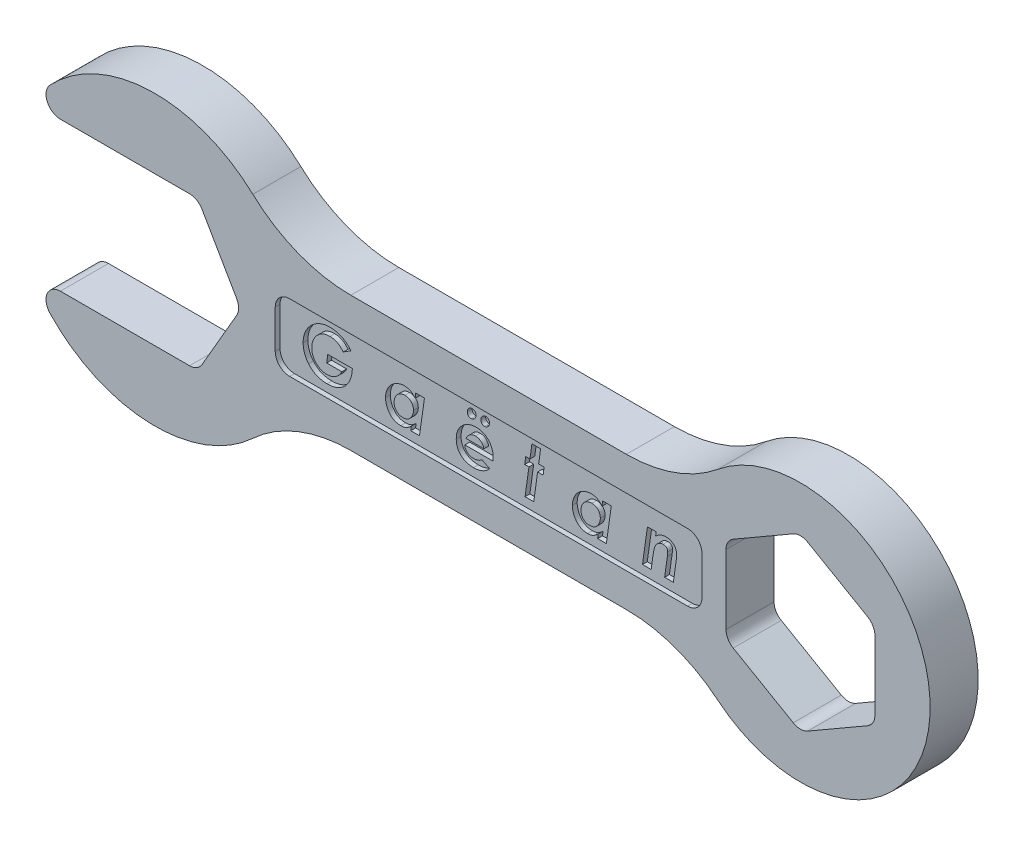
from build123d import *

# Parameters (mm, degrees)
ESQUISSE1_R                  = 27
BOSS_EXTRU_1_DEPTH           = 10
BOSS_EXTRU_2_DEPTH           = 10
ESQUISSE3_R                  = 30
BOSS_EXTRU_3_DEPTH           = 10
ENL_V_MAT_EXTRU_1_DEPTH      = 168.411635881
ENL_V_MAT_EXTRU_1_DEPTH_BACK = 168.411635881
CONG_1_R                     = 3
CONG_2_R                     = 30
CONG_3_R                     = 3
ESQUISSE5_W                  = 88.8410441
ESQUISSE5_H                  = 14
ENL_V_MAT_EXTRU_2_DEPTH      = 1
CONG_4_R                     = 3
ENL_V_MAT_EXTRU_3_DEPTH      = 1


with BuildPart() as part:
    # Esquisse1 → Boss.-Extru.1 (new body)
    with BuildSketch(Plane.XY):
        Circle(ESQUISSE1_R)
        Polygon((15.5, 8.948929172), (0, 17.897858345), (-15.5, 8.948929172), (-15.5, -8.948929172), (0, -17.897858345), (15.5, -8.948929172), align=None, mode=Mode.SUBTRACT)
    extrude(amount=BOSS_EXTRU_1_DEPTH)

    # Esquisse2 → Boss.-Extru.2 (add)
    with BuildSketch(Plane.XY.offset(10)):
        Polygon((-15.5, -8.948929172), (-15.5, -14), (-115.5, -14), (-115.5, 14), (-15.5, 14), (-15.5, 8.948929172), align=None)
    extrude(amount=-BOSS_EXTRU_2_DEPTH)

    # Esquisse3 → Boss.-Extru.3 (add)
    with BuildSketch(Plane.XY.offset(10)):
        with Locations((-134.397858345, 0)):
            Circle(ESQUISSE3_R)
        Polygon((-125.448929172, -15.5), (-116.5, 0), (-125.448929172, 15.5), (-143.346787517, 15.5), (-152.29571669, 0), (-143.346787517, -15.5), align=None, mode=Mode.SUBTRACT)
    extrude(amount=-BOSS_EXTRU_3_DEPTH)

    # Esquisse4 → Enlèv. mat.-Extru.1 (cut, two sides: drawn at the far end of the back side and taken through both)
    with BuildSketch(Plane.XY.offset(10).offset(-ENL_V_MAT_EXTRU_1_DEPTH_BACK)):
        with BuildLine():
            Line((-143.346787517, -15.5), (-160.083457423, -15.5))
            ThreePointArc((-160.083457423, -15.5), (-164.397858345, 0), (-160.083457423, 15.5))
            Line((-160.083457423, 15.5), (-143.346787517, 15.5))
            Line((-143.346787517, 15.5), (-143.346787517, -15.5))
        make_face()
    extrude(amount=ENL_V_MAT_EXTRU_1_DEPTH + ENL_V_MAT_EXTRU_1_DEPTH_BACK, mode=Mode.SUBTRACT)

    # Congé1
    cong_1_edges = [part.edges().sort_by_distance(p)[0] for p in [
        (-160.083457423, -15.5, 5),
        (-160.083457423, 15.5, 5),
    ]]
    fillet(cong_1_edges, radius=CONG_1_R)

    # Congé2
    cong_2_edges = [part.edges().sort_by_distance(p)[0] for p in [
        (-23.086792761, 14, 5),
        (-23.086792761, -14, 5),
        (-107.864860022, 14, 5),
        (-107.864860022, -14, 5),
    ]]
    fillet(cong_2_edges, radius=CONG_2_R)

    # Congé3
    cong_3_edges = [part.edges().sort_by_distance(p)[0] for p in [
        (0, -17.897858345, 5),
        (-15.5, -8.948929172, 5),
        (-15.5, 8.948929172, 5),
        (0, 17.897858345, 5),
        (15.5, 8.948929172, 5),
        (15.5, -8.948929172, 5),
        (-125.448929172, -15.5, 5),
        (-116.5, 0, 5),
        (-125.448929172, 15.5, 5),
    ]]
    fillet(cong_3_edges, radius=CONG_3_R)

    # Esquisse5 → Enlèv. mat.-Extru.2 (cut)
    with BuildSketch(Plane.XY.offset(10)):
        with Locations((-64.92052205, 0)):
            Rectangle(ESQUISSE5_W, ESQUISSE5_H)
    extrude(amount=-ENL_V_MAT_EXTRU_2_DEPTH, mode=Mode.SUBTRACT)

    # Congé4
    cong_4_edges = [part.edges().sort_by_distance(p)[0] for p in [
        (-109.3410441, -7, 9.5),
        (-109.3410441, 7, 9.5),
        (-20.5, 7, 9.5),
        (-20.5, -7, 9.5),
    ]]
    fillet(cong_4_edges, radius=CONG_4_R)

    # Esquisse6 → Enlèv. mat.-Extru.3 (cut)
    # profile 1 of 8: a face of its own
    with BuildSketch(Plane.XY.offset(9)):
        with BuildLine():
            Line((-94.571919832, 2.989043012), (-96.164467908, 1.991446858))
            add(Edge.make_bspline(
                [(-96.164467908, 1.991446858), (-96.277419058, 2.114827834), (-96.493196821, 2.350530359), (-96.831645132, 2.658707701), (-97.165043986, 2.90689395), (-97.498557313, 3.095834839), (-97.839775163, 3.236146336), (-98.19822987, 3.330547414), (-98.577652701, 3.390579904), (-98.837846108, 3.397938625), (-98.970958293, 3.401703269)],
                knots=[0, 0, 0, 0, 1.232977487, 2.355435308, 3.369770187, 4.291348691, 5.174604885, 6.082334442, 7.018942652, 8, 8, 8, 8], degree=3))
            add(Edge.make_bspline(
                [(-98.970958293, 3.401703269), (-99.115490325, 3.397872295), (-99.399547131, 3.39034307), (-99.813844544, 3.319094313), (-100.208591632, 3.210124919), (-100.582099351, 3.052289515), (-100.9345934, 2.848057336), (-101.266496712, 2.599964661), (-101.578041363, 2.30777085), (-101.761788383, 2.085078149), (-101.855573678, 1.971414807)],
                knots=[0, 0, 0, 0, 1.037106879, 2.038283569, 3.009830787, 3.972569298, 4.94146214, 5.928319872, 6.942605276, 8, 8, 8, 8], degree=3))
            add(Edge.make_bspline(
                [(-101.855573678, 1.971414807), (-101.926026019, 1.876399767), (-102.065201268, 1.688702076), (-102.242852967, 1.389991436), (-102.395935738, 1.085806484), (-102.521428475, 0.773103162), (-102.617449981, 0.45249395), (-102.685266921, 0.123347031), (-102.729103951, -0.212900732), (-102.734347847, -0.440309401), (-102.736983934, -0.55462686)],
                knots=[0, 0, 0, 0, 1.040960542, 2.056368018, 3.055559505, 4.03710588, 5.019268411, 5.998275661, 6.99374091, 8, 8, 8, 8], degree=3))
            add(Edge.make_bspline(
                [(-102.736983934, -0.55462686), (-102.734286479, -0.666254047), (-102.728968754, -0.886314242), (-102.687074815, -1.209356475), (-102.613250134, -1.517860985), (-102.51644785, -1.814171587), (-102.386816862, -2.095602765), (-102.229910574, -2.363420949), (-102.04444359, -2.616900645), (-101.832726331, -2.853929165), (-101.601070758, -3.07033734), (-101.353747156, -3.260016609), (-101.093168094, -3.419671609), (-100.819229088, -3.550406698), (-100.532100636, -3.653307307), (-100.231078726, -3.724668684), (-99.917889461, -3.770586023), (-99.704294808, -3.775361672), (-99.595958293, -3.777783911)],
                knots=[0, 0, 0, 0, 1.066897471, 2.103265977, 3.106535126, 4.095591644, 5.078159493, 6.062322472, 7.058152725, 8.075375883, 9.096057735, 10.084186963, 11.049730852, 12.011871914, 12.980953841, 13.959387168, 14.96498868, 16, 16, 16, 16], degree=3))
            add(Edge.make_bspline(
                [(-99.595958293, -3.777783911), (-99.514435579, -3.776273504), (-99.353034451, -3.773283154), (-99.11405091, -3.74854225), (-98.8804909, -3.708356851), (-98.652665022, -3.652823879), (-98.430597384, -3.579805203), (-98.213819767, -3.491296245), (-98.001734383, -3.387877411), (-97.796704058, -3.266502687), (-97.598400333, -3.131075327), (-97.409626621, -2.97820592), (-97.230806058, -2.808841949), (-97.060505165, -2.623875383), (-96.897611621, -2.424292465), (-96.747934509, -2.205923412), (-96.604789837, -1.973586972), (-96.518751271, -1.809837101), (-96.474964703, -1.72650186)],
                knots=[0, 0, 0, 0, 0.990751711, 1.961520103, 2.916931976, 3.869720035, 4.809138875, 5.755683625, 6.713987145, 7.674487982, 8.649319602, 9.630449541, 10.623757948, 11.640402946, 12.684918653, 13.752145235, 14.856026455, 16, 16, 16, 16], degree=3))
            Line((-96.474964703, -1.72650186), (-99.632015985, -1.72650186))
            Line((-99.632015985, -1.72650186), (-99.403650601, -0.059835193))
            Line((-99.403650601, -0.059835193), (-94.275445473, -0.059835193))
            add(Edge.make_bspline(
                [(-94.275445473, -0.059835193), (-94.288272854, -0.261135302), (-94.313357329, -0.654785982), (-94.404135998, -1.227988249), (-94.53858283, -1.768558767), (-94.712857132, -2.278580324), (-94.928718388, -2.757101648), (-95.189521398, -3.202825727), (-95.490156054, -3.617428393), (-95.833353404, -3.995474513), (-96.20915588, -4.334690114), (-96.610537731, -4.6343778), (-97.040546552, -4.882963894), (-97.493450118, -5.088310958), (-97.971030947, -5.249818953), (-98.474503274, -5.363046668), (-99.003043631, -5.432839648), (-99.364035163, -5.440532667), (-99.54788137, -5.444450578)],
                knots=[0, 0, 0, 0, 1.148955532, 2.246830018, 3.301660101, 4.319666133, 5.314146826, 6.287838685, 7.257462643, 8.227280698, 9.191724348, 10.138440807, 11.076252923, 12.016254752, 12.968042649, 13.943717582, 14.952773983, 16, 16, 16, 16], degree=3))
            add(Edge.make_bspline(
                [(-99.54788137, -5.444450578), (-99.648740567, -5.44345046), (-99.847994705, -5.441474661), (-100.1422145, -5.421177596), (-100.428167057, -5.386524913), (-100.705672683, -5.341008129), (-100.975954864, -5.282831074), (-101.237623978, -5.21118896), (-101.491287214, -5.125071663), (-101.735357506, -5.023038662), (-101.975031971, -4.915383095), (-102.202871638, -4.787135166), (-102.424477974, -4.649477628), (-102.636366611, -4.496461247), (-102.841731538, -4.33215287), (-103.037461789, -4.153923727), (-103.225270035, -3.962479877), (-103.342673065, -3.826514489), (-103.402048037, -3.75775186)],
                knots=[0, 0, 0, 0, 1.111499042, 2.195841241, 3.24834816, 4.285223882, 5.294222847, 6.294054786, 7.273859608, 8.244193736, 9.208986092, 10.167555097, 11.123181443, 12.083077344, 13.046240314, 14.020501641, 14.998895854, 16, 16, 16, 16], degree=3))
            add(Edge.make_bspline(
                [(-103.402048037, -3.75775186), (-103.492301507, -3.64376783), (-103.671496177, -3.417457082), (-103.90153463, -3.05280626), (-104.097844279, -2.672513108), (-104.25505173, -2.274634618), (-104.380732109, -1.862241568), (-104.468465193, -1.43306766), (-104.521247352, -0.987978159), (-104.528290254, -0.685647007), (-104.531855729, -0.532591603)],
                knots=[0, 0, 0, 0, 0.999328569, 1.984127054, 2.959716786, 3.938705326, 4.922250225, 5.921072174, 6.947541011, 8, 8, 8, 8], degree=3))
            add(Edge.make_bspline(
                [(-104.531855729, -0.532591603), (-104.527066492, -0.345330112), (-104.517616154, 0.024182671), (-104.436131046, 0.567453084), (-104.309384706, 1.092419785), (-104.124963592, 1.596453848), (-103.892159463, 2.082415673), (-103.604561183, 2.546576558), (-103.269134721, 2.994100413), (-102.88295103, 3.412804014), (-102.464152011, 3.799767406), (-102.019453081, 4.139675802), (-101.553143019, 4.425786183), (-101.069026342, 4.662719438), (-100.562481952, 4.842868733), (-100.037962039, 4.973249329), (-99.492961203, 5.054042999), (-99.122813155, 5.063545708), (-98.934900601, 5.068369935)],
                knots=[0, 0, 0, 0, 1.022519879, 2.01768214, 2.99445506, 3.968403767, 4.944092992, 5.933246428, 6.946641619, 7.994936793, 9.040543676, 10.058341478, 11.047494914, 12.024771785, 12.997483176, 13.978673844, 14.973836105, 16, 16, 16, 16], degree=3))
            add(Edge.make_bspline(
                [(-98.934900601, 5.068369935), (-98.793865295, 5.066084321), (-98.513029442, 5.061533103), (-98.09557903, 5.012235686), (-97.682666972, 4.939787971), (-97.278292694, 4.832505996), (-96.885112506, 4.701664459), (-96.50846647, 4.545031186), (-96.151988233, 4.363103439), (-95.813036558, 4.154064145), (-95.488245835, 3.915513975), (-95.171476627, 3.643021751), (-94.863720546, 3.332651357), (-94.67058781, 3.105228953), (-94.571919832, 2.989043012)],
                knots=[0, 0, 0, 0, 1.014010841, 2.019144067, 3.019687909, 4.027399918, 5.025300219, 5.998481464, 6.958680332, 7.901091373, 8.859847597, 9.854378501, 10.903841272, 12, 12, 12, 12], degree=3))
        make_face()
    # profile 2 of 8: a face of its own
    with BuildSketch(Plane.XY.offset(9)):
        with BuildLine():
            Line((-81.083939062, 2.119651987), (-79.273041626, 2.119651987))
            Line((-79.273041626, 2.119651987), (-80.310701883, -5.188040321))
            Line((-80.310701883, -5.188040321), (-82.121599319, -5.188040321))
            Line((-82.121599319, -5.188040321), (-81.995397396, -4.294610834))
            add(Edge.make_bspline(
                [(-81.995397396, -4.294610834), (-82.0895592, -4.384240072), (-82.269109058, -4.555147129), (-82.547199891, -4.776870844), (-82.814894883, -4.9571942), (-83.078811967, -5.095499884), (-83.346200206, -5.195842891), (-83.623750028, -5.265343641), (-83.917105045, -5.308810608), (-84.117971174, -5.313725506), (-84.220958293, -5.316245449)],
                knots=[0, 0, 0, 0, 1.236324186, 2.357450916, 3.379388742, 4.30284698, 5.185433758, 6.089881904, 7.020653398, 8, 8, 8, 8], degree=3))
            add(Edge.make_bspline(
                [(-84.220958293, -5.316245449), (-84.338674928, -5.313503079), (-84.569216749, -5.308132291), (-84.90551363, -5.25615881), (-85.223434043, -5.174873397), (-85.5231277, -5.060177194), (-85.802975255, -4.910466063), (-86.065655958, -4.728980314), (-86.308794413, -4.513485833), (-86.529056074, -4.266833062), (-86.727698416, -4.000988481), (-86.900477198, -3.720068469), (-87.050504246, -3.430645687), (-87.167277116, -3.127432687), (-87.263671976, -2.816100159), (-87.328202292, -2.492495849), (-87.369829032, -2.158943176), (-87.375261625, -1.932958393), (-87.378009575, -1.818649296)],
                knots=[0, 0, 0, 0, 1.072254913, 2.099954687, 3.093402483, 4.05863531, 5.017013142, 5.979305845, 6.962352722, 7.970695896, 8.988290287, 9.983079422, 10.973839091, 11.95483031, 12.940586347, 13.940815436, 14.958409826, 16, 16, 16, 16], degree=3))
            add(Edge.make_bspline(
                [(-87.378009575, -1.818649296), (-87.376630759, -1.730444021), (-87.373887871, -1.554976709), (-87.346797222, -1.293247041), (-87.302656363, -1.035081459), (-87.242032506, -0.779623273), (-87.1664656, -0.526942523), (-87.07200178, -0.277947328), (-86.958689862, -0.03313905), (-86.831321988, 0.207775355), (-86.690734969, 0.441890237), (-86.533027812, 0.661627407), (-86.367478012, 0.871002708), (-86.18877532, 1.065910859), (-85.997370115, 1.245715574), (-85.797208027, 1.416086673), (-85.581843746, 1.568770121), (-85.358860906, 1.711740389), (-85.126964278, 1.836228271), (-84.892438443, 1.948098457), (-84.653471864, 2.039295855), (-84.413078121, 2.116495021), (-84.169161709, 2.174467967), (-83.922913601, 2.21613913), (-83.674044356, 2.243794026), (-83.507222142, 2.246501363), (-83.423682652, 2.247857115)],
                knots=[0, 0, 0, 0, 1.010861959, 2.01091412, 3.012605424, 4.011485121, 5.018863341, 6.033918867, 7.061452407, 8.109228878, 9.15680961, 10.18900835, 11.207521355, 12.215190347, 13.216881651, 14.216552911, 15.225616441, 16.240671966, 17.251099115, 18.240697123, 19.217272556, 20.180771028, 21.133199006, 22.08832996, 23.042693801, 24, 24, 24, 24], degree=3))
            add(Edge.make_bspline(
                [(-83.423682652, 2.247857115), (-83.312585771, 2.244691937), (-83.093597875, 2.238452917), (-82.772858072, 2.179966858), (-82.465595343, 2.087464635), (-82.172570263, 1.959187864), (-81.897383967, 1.795734879), (-81.648072372, 1.594394628), (-81.419002212, 1.363612336), (-81.293790615, 1.184841133), (-81.230173037, 1.094010961)],
                knots=[0, 0, 0, 0, 1.030509072, 2.031281277, 3.015697838, 4.003854478, 4.993584726, 5.977161716, 6.972235198, 8, 8, 8, 8], degree=3))
            Line((-81.230173037, 1.094010961), (-81.083939062, 2.119651987))
        make_face()
        with BuildLine():
            add(Edge.make_bspline(
                [(-83.818314062, -3.649578783), (-83.71388913, -3.646351159), (-83.510241026, -3.64005669), (-83.216024056, -3.584297883), (-82.941854782, -3.496492122), (-82.688147484, -3.370973597), (-82.454029672, -3.205890685), (-82.241518864, -2.999854791), (-82.049576722, -2.753038153), (-81.881246726, -2.472876878), (-81.740568327, -2.171565884), (-81.637495536, -1.8604959), (-81.571763243, -1.545637561), (-81.564383312, -1.333518143), (-81.560701883, -1.227703783)],
                knots=[0, 0, 0, 0, 1.017901168, 1.985097214, 2.910041334, 3.818973104, 4.735274743, 5.693545178, 6.695670165, 7.777101795, 8.875856117, 9.932619244, 10.968700869, 12, 12, 12, 12], degree=3))
            add(Edge.make_bspline(
                [(-81.560701883, -1.227703783), (-81.562385983, -1.161543843), (-81.56569561, -1.031525021), (-81.587329759, -0.841659408), (-81.625361193, -0.661800241), (-81.67992974, -0.492058632), (-81.749632862, -0.332252034), (-81.834987147, -0.181911956), (-81.934773811, -0.042091072), (-82.04947085, 0.087091193), (-82.177645113, 0.201541305), (-82.313545439, 0.306466258), (-82.463489727, 0.388858433), (-82.620209744, 0.460755607), (-82.787988133, 0.513789359), (-82.964541549, 0.555110838), (-83.152076144, 0.576113591), (-83.280077237, 0.579472275), (-83.345557652, 0.581190448)],
                knots=[0, 0, 0, 0, 1.109141645, 2.179707075, 3.198451464, 4.18615572, 5.163657463, 6.116161664, 7.079133258, 8.038519567, 9.005387219, 9.956904198, 10.909408399, 11.866440704, 12.843493655, 13.853714903, 14.902043453, 16, 16, 16, 16], degree=3))
            add(Edge.make_bspline(
                [(-83.345557652, 0.581190448), (-83.421809654, 0.579526012), (-83.572340996, 0.5762402), (-83.793544996, 0.542304083), (-84.006896867, 0.491633295), (-84.210330926, 0.415806748), (-84.405969774, 0.322348928), (-84.590771363, 0.204271225), (-84.768328652, 0.067451605), (-84.934871859, -0.089408877), (-85.086780017, -0.262970349), (-85.219732112, -0.45020679), (-85.332872893, -0.650050517), (-85.425063703, -0.862189038), (-85.494863426, -1.087531469), (-85.547383376, -1.323165973), (-85.577632535, -1.572135368), (-85.58127315, -1.741778449), (-85.58313778, -1.828665321)],
                knots=[0, 0, 0, 0, 0.994897251, 1.964056203, 2.915642991, 3.853470011, 4.79324038, 5.741466074, 6.711095529, 7.716481674, 8.723680824, 9.71796663, 10.70964959, 11.717112863, 12.731868792, 13.785363818, 14.865719672, 16, 16, 16, 16], degree=3))
            add(Edge.make_bspline(
                [(-85.58313778, -1.828665321), (-85.581423622, -1.895482824), (-85.578071444, -2.026150001), (-85.55699209, -2.217628059), (-85.51594215, -2.398304381), (-85.462038516, -2.569355665), (-85.39403764, -2.730946632), (-85.309340722, -2.88208943), (-85.208503109, -3.023066272), (-85.09297705, -3.152731296), (-84.964335125, -3.268163523), (-84.828009149, -3.37188354), (-84.681073602, -3.457759659), (-84.525534171, -3.528772238), (-84.360821245, -3.582734144), (-84.187518679, -3.619966994), (-84.006026897, -3.64543278), (-83.881839879, -3.648175692), (-83.818314062, -3.649578783)],
                knots=[0, 0, 0, 0, 1.124431694, 2.198919568, 3.234766021, 4.236791382, 5.213425507, 6.179206721, 7.145706547, 8.12447102, 9.094881178, 10.04988442, 11.001776355, 11.952075609, 12.922030374, 13.911569148, 14.931697721, 16, 16, 16, 16], degree=3))
        make_face(mode=Mode.SUBTRACT)
    # profile 3 of 8: a face of its own
    with BuildSketch(Plane.XY.offset(9)):
        with BuildLine():
            Line((-67.291471114, -3.026581988), (-65.722961498, -3.831870449))
            add(Edge.make_bspline(
                [(-65.722961498, -3.831870449), (-65.815622752, -3.942737196), (-66.001872333, -4.165579909), (-66.336693501, -4.454399124), (-66.711296099, -4.710417088), (-67.126989144, -4.926913661), (-67.575918538, -5.102272841), (-68.052936197, -5.224328429), (-68.55279933, -5.304324781), (-68.894385916, -5.312223567), (-69.068314062, -5.316245449)],
                knots=[0, 0, 0, 0, 0.914244933, 1.837636877, 2.790537697, 3.784087733, 4.800790172, 5.83726639, 6.89878507, 8, 8, 8, 8], degree=3))
            add(Edge.make_bspline(
                [(-69.068314062, -5.316245449), (-69.204005864, -5.313939148), (-69.468136064, -5.30944983), (-69.853188467, -5.263386723), (-70.217062917, -5.193248582), (-70.557910051, -5.090104092), (-70.878634156, -4.96234155), (-71.175278477, -4.801632307), (-71.449773576, -4.611216439), (-71.702144596, -4.396270052), (-71.926396591, -4.154521065), (-72.124112877, -3.894385573), (-72.288910616, -3.61255085), (-72.426416409, -3.313833293), (-72.529707118, -2.994018546), (-72.606581586, -2.657046016), (-72.6502843, -2.299892057), (-72.656750065, -2.055810597), (-72.660060857, -1.930828783)],
                knots=[0, 0, 0, 0, 1.167516698, 2.272623801, 3.333371772, 4.353538571, 5.333382306, 6.300396664, 7.250661637, 8.204535574, 9.148031545, 10.083792083, 11.011414416, 11.952824574, 12.908912643, 13.898953575, 14.92416002, 16, 16, 16, 16], degree=3))
            add(Edge.make_bspline(
                [(-72.660060857, -1.930828783), (-72.657098035, -1.787048272), (-72.651270931, -1.50426931), (-72.590380495, -1.089899593), (-72.496584471, -0.691934241), (-72.365119274, -0.310598078), (-72.191727367, 0.052404075), (-71.986144228, 0.401280557), (-71.737415772, 0.729777005), (-71.456336232, 1.038732446), (-71.149098483, 1.320183834), (-70.823333049, 1.568959295), (-70.480138442, 1.778690433), (-70.12205084, 1.95123103), (-69.747380593, 2.08522986), (-69.35699017, 2.177800367), (-68.951385098, 2.238952655), (-68.675243669, 2.244864535), (-68.535461498, 2.247857115)],
                knots=[0, 0, 0, 0, 1.05529311, 2.075487762, 3.068699193, 4.055083011, 5.031283693, 6.018666653, 7.023995929, 8.051577733, 9.082465902, 10.079966066, 11.057287041, 12.031169187, 12.994424047, 13.973330935, 14.974104677, 16, 16, 16, 16], degree=3))
            add(Edge.make_bspline(
                [(-68.535461498, 2.247857115), (-68.45063295, 2.245974391), (-68.283417398, 2.242263133), (-68.035645699, 2.223114205), (-67.795882746, 2.185754779), (-67.562418725, 2.139223604), (-67.337183875, 2.074113632), (-67.118944837, 1.995309451), (-66.905449005, 1.906597551), (-66.701981943, 1.798882032), (-66.504866956, 1.682426044), (-66.320448578, 1.548086939), (-66.143996923, 1.404962374), (-65.978589966, 1.248130586), (-65.826769316, 1.076730952), (-65.683428686, 0.893952875), (-65.551971554, 0.697184156), (-65.42974645, 0.490381975), (-65.322750079, 0.273311426), (-65.225405786, 0.053086923), (-65.148336006, -0.17420704), (-65.080357474, -0.404172511), (-65.032452358, -0.64110084), (-64.992009781, -0.881281671), (-64.973601342, -1.126590486), (-64.969711266, -1.291120332), (-64.967753165, -1.373937757)],
                knots=[0, 0, 0, 0, 1.072343926, 2.113823519, 3.137889586, 4.13760148, 5.120645553, 6.097657508, 7.069516392, 8.039614793, 9.005002879, 9.960565349, 10.920144366, 11.87525951, 12.837543921, 13.811635494, 14.808779264, 15.826321551, 16.845367656, 17.865985152, 18.866871901, 19.876579391, 20.894541571, 21.919893521, 22.952961626, 24, 24, 24, 24], degree=3))
            add(Edge.make_bspline(
                [(-64.967753165, -1.373937757), (-64.968609393, -1.428709101), (-64.970386358, -1.542378398), (-64.982879367, -1.720224856), (-65.005209109, -1.911238458), (-65.025426193, -2.043067712), (-65.035862139, -2.111117244)],
                knots=[0, 0, 0, 0, 0.886860648, 1.840539587, 2.885298471, 4, 4, 4, 4], degree=3))
            Line((-65.035862139, -2.111117244), (-70.865189062, -2.111117244))
            add(Edge.make_bspline(
                [(-70.865189062, -2.111117244), (-70.861363959, -2.16861727), (-70.853902064, -2.28078656), (-70.828711033, -2.444246023), (-70.785875689, -2.597734916), (-70.729369096, -2.742297044), (-70.661172165, -2.879589292), (-70.579259679, -3.008988803), (-70.480095572, -3.126533162), (-70.369339222, -3.235897301), (-70.245884586, -3.333586877), (-70.110270832, -3.417616048), (-69.964908345, -3.491563697), (-69.80620009, -3.547888216), (-69.637720384, -3.594925016), (-69.457829929, -3.625858987), (-69.267138436, -3.646989536), (-69.135818015, -3.648699693), (-69.068314062, -3.649578783)],
                knots=[0, 0, 0, 0, 1.040300458, 2.029386266, 2.980027991, 3.911437883, 4.828060054, 5.744444316, 6.66911896, 7.598419554, 8.551199615, 9.504589747, 10.47513087, 11.489753162, 12.539789264, 13.630032591, 14.781741895, 16, 16, 16, 16], degree=3))
            add(Edge.make_bspline(
                [(-69.068314062, -3.649578783), (-68.986121338, -3.647443441), (-68.823263331, -3.643212441), (-68.582249386, -3.615855151), (-68.348819292, -3.564395155), (-68.122371707, -3.496434921), (-67.902030993, -3.411006954), (-67.691842061, -3.30058416), (-67.485589402, -3.175220744), (-67.356728362, -3.076550264), (-67.291471114, -3.026581988)],
                knots=[0, 0, 0, 0, 1.027214308, 2.035339218, 3.025519259, 4.010199041, 4.987959988, 5.973205312, 6.973599434, 8, 8, 8, 8], degree=3))
        make_face()
        with BuildLine():
            add(Edge.make_bspline(
                [(-66.890830088, -0.829065962), (-66.926450284, -0.719006924), (-66.995037538, -0.507086495), (-67.144649688, -0.219396822), (-67.327280572, 0.026409765), (-67.543154803, 0.22856904), (-67.788138902, 0.386009981), (-68.057564398, 0.499880195), (-68.351619208, 0.570024521), (-68.556431603, 0.577400631), (-68.661663421, 0.581190448)],
                knots=[0, 0, 0, 0, 1.131480038, 2.178682812, 3.159669316, 4.117470342, 5.058967564, 5.99670948, 6.970717055, 8, 8, 8, 8], degree=3))
            add(Edge.make_bspline(
                [(-68.661663421, 0.581190448), (-68.766939726, 0.577493293), (-68.974596402, 0.570200684), (-69.276299704, 0.495896435), (-69.563715163, 0.381440698), (-69.830626267, 0.217708808), (-70.077674532, 0.015810532), (-70.289720046, -0.230828675), (-70.476594851, -0.511496766), (-70.567864201, -0.721233979), (-70.614788421, -0.829065962)],
                knots=[0, 0, 0, 0, 0.983432494, 1.939812791, 2.890131691, 3.868528921, 4.858194814, 5.863362488, 6.901492691, 8, 8, 8, 8], degree=3))
            Line((-70.614788421, -0.829065962), (-66.890830088, -0.829065962))
        make_face(mode=Mode.SUBTRACT)
    # profile 4 of 8: a face of its own
    with BuildSketch(Plane.XY.offset(9)):
        with BuildLine():
            add(Edge.make_bspline(
                [(-69.320717908, 5.196575063), (-69.268954684, 5.194192723), (-69.167428122, 5.189520083), (-69.021819024, 5.143048616), (-68.888870081, 5.067895335), (-68.775035887, 4.96298994), (-68.677909489, 4.841458149), (-68.606768601, 4.704282421), (-68.565570215, 4.553884047), (-68.560229478, 4.450298429), (-68.557496755, 4.397296217)],
                knots=[0, 0, 0, 0, 1.00831808, 1.977679521, 2.953075207, 3.968955148, 4.981229248, 5.978608684, 6.965703817, 8, 8, 8, 8], degree=3))
            add(Edge.make_bspline(
                [(-68.557496755, 4.397296217), (-68.560574155, 4.322132266), (-68.566574948, 4.175565889), (-68.625106946, 3.964488487), (-68.721203523, 3.771476024), (-68.850154819, 3.598387139), (-69.006281628, 3.454807636), (-69.183281466, 3.349211433), (-69.377671945, 3.283841725), (-69.513855973, 3.276985933), (-69.58313778, 3.27349814)],
                knots=[0, 0, 0, 0, 1.065062646, 2.076824982, 3.081502467, 4.110916351, 5.124098581, 6.0718497, 7.019079256, 8, 8, 8, 8], degree=3))
            add(Edge.make_bspline(
                [(-69.58313778, 3.27349814), (-69.63824421, 3.275765528), (-69.745044014, 3.28015987), (-69.896345165, 3.326528489), (-70.032134131, 3.399035383), (-70.146767415, 3.503134238), (-70.238511186, 3.629701209), (-70.306950629, 3.775465044), (-70.343834255, 3.940105378), (-70.349457746, 4.055245842), (-70.352368549, 4.114844294)],
                knots=[0, 0, 0, 0, 1.028826853, 1.993932558, 2.933770189, 3.88992824, 4.865102085, 5.843875107, 6.883957036, 8, 8, 8, 8], degree=3))
            add(Edge.make_bspline(
                [(-70.352368549, 4.114844294), (-70.34835029, 4.18466193), (-70.340449121, 4.321945476), (-70.282301571, 4.521483469), (-70.183394927, 4.70628406), (-70.050885807, 4.873468717), (-69.89278899, 5.016267284), (-69.714345182, 5.118926491), (-69.522422294, 5.18651821), (-69.388726244, 5.193184211), (-69.320717908, 5.196575063)],
                knots=[0, 0, 0, 0, 1.013440592, 1.992744627, 2.990701936, 4.040532329, 5.078057221, 6.064636022, 7.015521524, 8, 8, 8, 8], degree=3))
        make_face()
    # profile 5 of 8: a face of its own
    with BuildSketch(Plane.XY.offset(9)):
        with BuildLine():
            add(Edge.make_bspline(
                [(-66.500205088, 5.196575063), (-66.448441864, 5.194192723), (-66.346915301, 5.189520083), (-66.201306203, 5.143048616), (-66.06835726, 5.067895335), (-65.954523066, 4.96298994), (-65.857396669, 4.841458149), (-65.786255781, 4.704282421), (-65.745057394, 4.553884047), (-65.739716658, 4.450298429), (-65.736983934, 4.397296217)],
                knots=[0, 0, 0, 0, 1.00831808, 1.977679521, 2.953075207, 3.968955148, 4.981229248, 5.978608684, 6.965703817, 8, 8, 8, 8], degree=3))
            add(Edge.make_bspline(
                [(-65.736983934, 4.397296217), (-65.740061334, 4.322132266), (-65.746062128, 4.175565889), (-65.804594126, 3.964488487), (-65.900690703, 3.771476024), (-66.029641998, 3.598387139), (-66.185768807, 3.454807636), (-66.362768646, 3.349211433), (-66.557159125, 3.283841725), (-66.693343152, 3.276985933), (-66.76262496, 3.27349814)],
                knots=[0, 0, 0, 0, 1.065062646, 2.076824982, 3.081502467, 4.110916351, 5.124098581, 6.0718497, 7.019079256, 8, 8, 8, 8], degree=3))
            add(Edge.make_bspline(
                [(-66.76262496, 3.27349814), (-66.81773139, 3.275765528), (-66.924531193, 3.28015987), (-67.075832344, 3.326528489), (-67.211621311, 3.399035383), (-67.326254594, 3.503134238), (-67.417998365, 3.629701209), (-67.486437809, 3.775465044), (-67.523321435, 3.940105378), (-67.528944925, 4.055245842), (-67.531855729, 4.114844294)],
                knots=[0, 0, 0, 0, 1.028826853, 1.993932558, 2.933770189, 3.88992824, 4.865102085, 5.843875107, 6.883957036, 8, 8, 8, 8], degree=3))
            add(Edge.make_bspline(
                [(-67.531855729, 4.114844294), (-67.527837469, 4.18466193), (-67.5199363, 4.321945476), (-67.46178875, 4.521483469), (-67.362882106, 4.70628406), (-67.230372987, 4.873468717), (-67.07227617, 5.016267284), (-66.893832361, 5.118926491), (-66.701909473, 5.18651821), (-66.568213424, 5.193184211), (-66.500205088, 5.196575063)],
                knots=[0, 0, 0, 0, 1.013440592, 1.992744627, 2.990701936, 4.040532329, 5.078057221, 6.064636022, 7.015521524, 8, 8, 8, 8], degree=3))
        make_face()
    # profile 6 of 8: a face of its own
    with BuildSketch(Plane.XY.offset(9)):
        Polygon((-56.904451883, 5.068369935), (-55.095557652, 5.068369935), (-55.504211498, 2.119651987), (-54.36038137, 2.119651987), (-54.576727524, 0.581190448), (-55.718554447, 0.581190448), (-56.517833293, -5.188040321), (-58.326727524, -5.188040321), (-57.527448678, 0.581190448), (-58.412865344, 0.581190448), (-58.204532011, 2.119651987), (-57.313105729, 2.119651987), align=None)
    # profile 7 of 8: a face of its own
    with BuildSketch(Plane.XY.offset(9)):
        with BuildLine():
            Line((-42.186503165, 2.119651987), (-40.375605729, 2.119651987))
            Line((-40.375605729, 2.119651987), (-41.413265985, -5.188040321))
            Line((-41.413265985, -5.188040321), (-43.224163421, -5.188040321))
            Line((-43.224163421, -5.188040321), (-43.097961498, -4.294610834))
            add(Edge.make_bspline(
                [(-43.097961498, -4.294610834), (-43.192123303, -4.384240072), (-43.37167316, -4.555147129), (-43.649763993, -4.776870844), (-43.917458986, -4.9571942), (-44.18137607, -5.095499884), (-44.448764309, -5.195842891), (-44.726314131, -5.265343641), (-45.019669148, -5.308810608), (-45.220535276, -5.313725506), (-45.323522396, -5.316245449)],
                knots=[0, 0, 0, 0, 1.236324186, 2.357450916, 3.379388742, 4.30284698, 5.185433758, 6.089881904, 7.020653398, 8, 8, 8, 8], degree=3))
            add(Edge.make_bspline(
                [(-45.323522396, -5.316245449), (-45.441239031, -5.313503079), (-45.671780851, -5.308132291), (-46.008077733, -5.25615881), (-46.325998145, -5.174873397), (-46.625691802, -5.060177194), (-46.905539358, -4.910466063), (-47.16822006, -4.728980314), (-47.411358515, -4.513485833), (-47.631620177, -4.266833062), (-47.830262519, -4.000988481), (-48.003041301, -3.720068469), (-48.153068349, -3.430645687), (-48.269841218, -3.127432687), (-48.366236078, -2.816100159), (-48.430766395, -2.492495849), (-48.472393134, -2.158943176), (-48.477825728, -1.932958393), (-48.480573678, -1.818649296)],
                knots=[0, 0, 0, 0, 1.072254913, 2.099954687, 3.093402483, 4.05863531, 5.017013142, 5.979305845, 6.962352722, 7.970695896, 8.988290287, 9.983079422, 10.973839091, 11.95483031, 12.940586347, 13.940815436, 14.958409826, 16, 16, 16, 16], degree=3))
            add(Edge.make_bspline(
                [(-48.480573678, -1.818649296), (-48.479194861, -1.730444021), (-48.476451974, -1.554976709), (-48.449361324, -1.293247041), (-48.405220466, -1.035081459), (-48.344596609, -0.779623273), (-48.269029703, -0.526942523), (-48.174565882, -0.277947328), (-48.061253965, -0.03313905), (-47.93388609, 0.207775355), (-47.793299071, 0.441890237), (-47.635591915, 0.661627407), (-47.470042114, 0.871002708), (-47.291339423, 1.065910859), (-47.099934218, 1.245715574), (-46.89977213, 1.416086673), (-46.684407848, 1.568770121), (-46.461425009, 1.711740389), (-46.229528381, 1.836228271), (-45.995002545, 1.948098457), (-45.756035967, 2.039295855), (-45.515642224, 2.116495021), (-45.271725811, 2.174467967), (-45.025477703, 2.21613913), (-44.776608459, 2.243794026), (-44.609786244, 2.246501363), (-44.526246755, 2.247857115)],
                knots=[0, 0, 0, 0, 1.010861959, 2.01091412, 3.012605424, 4.011485121, 5.018863341, 6.033918867, 7.061452407, 8.109228878, 9.15680961, 10.18900835, 11.207521355, 12.215190347, 13.216881651, 14.216552911, 15.225616441, 16.240671966, 17.251099115, 18.240697123, 19.217272556, 20.180771028, 21.133199006, 22.08832996, 23.042693801, 24, 24, 24, 24], degree=3))
            add(Edge.make_bspline(
                [(-44.526246755, 2.247857115), (-44.415149874, 2.244691937), (-44.196161978, 2.238452917), (-43.875422175, 2.179966858), (-43.568159445, 2.087464635), (-43.275134365, 1.959187864), (-42.99994807, 1.795734879), (-42.750636475, 1.594394628), (-42.521566315, 1.363612336), (-42.396354717, 1.184841133), (-42.332737139, 1.094010961)],
                knots=[0, 0, 0, 0, 1.030509072, 2.031281277, 3.015697838, 4.003854478, 4.993584726, 5.977161716, 6.972235198, 8, 8, 8, 8], degree=3))
            Line((-42.332737139, 1.094010961), (-42.186503165, 2.119651987))
        make_face()
        with BuildLine():
            add(Edge.make_bspline(
                [(-44.920878165, -3.649578783), (-44.816453232, -3.646351159), (-44.612805129, -3.64005669), (-44.318588158, -3.584297883), (-44.044418884, -3.496492122), (-43.790711587, -3.370973597), (-43.556593774, -3.205890685), (-43.344082966, -2.999854791), (-43.152140825, -2.753038153), (-42.983810828, -2.472876878), (-42.84313243, -2.171565884), (-42.740059639, -1.8604959), (-42.674327346, -1.545637561), (-42.666947415, -1.333518143), (-42.663265985, -1.227703783)],
                knots=[0, 0, 0, 0, 1.017901168, 1.985097214, 2.910041334, 3.818973104, 4.735274743, 5.693545178, 6.695670165, 7.777101795, 8.875856117, 9.932619244, 10.968700869, 12, 12, 12, 12], degree=3))
            add(Edge.make_bspline(
                [(-42.663265985, -1.227703783), (-42.664950085, -1.161543843), (-42.668259712, -1.031525021), (-42.689893862, -0.841659408), (-42.727925295, -0.661800241), (-42.782493842, -0.492058632), (-42.852196965, -0.332252034), (-42.93755125, -0.181911956), (-43.037337913, -0.042091072), (-43.152034952, 0.087091193), (-43.280209215, 0.201541305), (-43.416109541, 0.306466258), (-43.56605383, 0.388858433), (-43.722773846, 0.460755607), (-43.890552236, 0.513789359), (-44.067105652, 0.555110838), (-44.254640246, 0.576113591), (-44.38264134, 0.579472275), (-44.448121755, 0.581190448)],
                knots=[0, 0, 0, 0, 1.109141645, 2.179707075, 3.198451464, 4.18615572, 5.163657463, 6.116161664, 7.079133258, 8.038519567, 9.005387219, 9.956904198, 10.909408399, 11.866440704, 12.843493655, 13.853714903, 14.902043453, 16, 16, 16, 16], degree=3))
            add(Edge.make_bspline(
                [(-44.448121755, 0.581190448), (-44.524373757, 0.579526012), (-44.674905098, 0.5762402), (-44.896109099, 0.542304083), (-45.109460969, 0.491633295), (-45.312895028, 0.415806748), (-45.508533877, 0.322348928), (-45.693335466, 0.204271225), (-45.870892755, 0.067451605), (-46.037435961, -0.089408877), (-46.189344119, -0.262970349), (-46.322296214, -0.45020679), (-46.435436995, -0.650050517), (-46.527627805, -0.862189038), (-46.597427529, -1.087531469), (-46.649947478, -1.323165973), (-46.680196638, -1.572135368), (-46.683837253, -1.741778449), (-46.685701883, -1.828665321)],
                knots=[0, 0, 0, 0, 0.994897251, 1.964056203, 2.915642991, 3.853470011, 4.79324038, 5.741466074, 6.711095529, 7.716481674, 8.723680824, 9.71796663, 10.70964959, 11.717112863, 12.731868792, 13.785363818, 14.865719672, 16, 16, 16, 16], degree=3))
            add(Edge.make_bspline(
                [(-46.685701883, -1.828665321), (-46.683987725, -1.895482824), (-46.680635547, -2.026150001), (-46.659556192, -2.217628059), (-46.618506252, -2.398304381), (-46.564602618, -2.569355665), (-46.496601743, -2.730946632), (-46.411904824, -2.88208943), (-46.311067212, -3.023066272), (-46.195541152, -3.152731296), (-46.066899227, -3.268163523), (-45.930573251, -3.37188354), (-45.783637705, -3.457759659), (-45.628098274, -3.528772238), (-45.463385347, -3.582734144), (-45.290082782, -3.619966994), (-45.108590999, -3.64543278), (-44.984403981, -3.648175692), (-44.920878165, -3.649578783)],
                knots=[0, 0, 0, 0, 1.124431694, 2.198919568, 3.234766021, 4.236791382, 5.213425507, 6.179206721, 7.145706547, 8.12447102, 9.094881178, 10.04988442, 11.001776355, 11.952075609, 12.922030374, 13.911569148, 14.931697721, 16, 16, 16, 16], degree=3))
        make_face(mode=Mode.SUBTRACT)
    # profile 8 of 8: a face of its own
    with BuildSketch(Plane.XY.offset(9)):
        with BuildLine():
            Line((-32.853169832, 2.119651987), (-31.042272396, 2.119651987))
            Line((-31.042272396, 2.119651987), (-31.156455088, 1.31236032))
            add(Edge.make_bspline(
                [(-31.156455088, 1.31236032), (-31.069380901, 1.386497118), (-30.899170925, 1.531417478), (-30.631365125, 1.721369597), (-30.36333739, 1.886436855), (-30.089594601, 2.015555846), (-29.814759933, 2.120189798), (-29.536896242, 2.19370678), (-29.255653754, 2.240325326), (-29.06729101, 2.245343887), (-28.972961498, 2.247857115)],
                knots=[0, 0, 0, 0, 1.129074261, 2.207080079, 3.239806547, 4.233987332, 5.191979582, 6.140686111, 7.068880775, 8, 8, 8, 8], degree=3))
            add(Edge.make_bspline(
                [(-28.972961498, 2.247857115), (-28.894113637, 2.245615347), (-28.739329034, 2.24121458), (-28.512417401, 2.21606888), (-28.297355818, 2.16937695), (-28.092792896, 2.105789299), (-27.900699732, 2.020076513), (-27.716479737, 1.921052949), (-27.545962956, 1.798835372), (-27.386234414, 1.662130208), (-27.243381889, 1.509916876), (-27.115304772, 1.349681118), (-27.009016288, 1.177674684), (-26.919919587, 0.996944928), (-26.851649154, 0.80533556), (-26.803862348, 0.604496993), (-26.775408313, 0.394371023), (-26.771452405, 0.251417576), (-26.769435857, 0.178546217)],
                knots=[0, 0, 0, 0, 1.118022855, 2.194767494, 3.230795032, 4.233728951, 5.225657328, 6.208555818, 7.193457995, 8.193528683, 9.184553253, 10.148487881, 11.096723343, 12.045053303, 13.000209424, 13.973718189, 14.967090947, 16, 16, 16, 16], degree=3))
            add(Edge.make_bspline(
                [(-26.769435857, 0.178546217), (-26.771596745, 0.099733292), (-26.776381224, -0.0747685), (-26.796706338, -0.362964462), (-26.836958431, -0.701856042), (-26.868666491, -0.945289127), (-26.885621755, -1.075460193)],
                knots=[0, 0, 0, 0, 0.750743129, 1.6622403, 2.749928862, 4, 4, 4, 4], degree=3))
            Line((-26.885621755, -1.075460193), (-27.464548037, -5.188040321))
            Line((-27.464548037, -5.188040321), (-29.275445473, -5.188040321))
            Line((-29.275445473, -5.188040321), (-28.708538421, -1.165604424))
            add(Edge.make_bspline(
                [(-28.708538421, -1.165604424), (-28.696172773, -1.074170842), (-28.673094327, -0.903525121), (-28.646071939, -0.665877074), (-28.631793735, -0.464647031), (-28.628079035, -0.342969054), (-28.626407011, -0.288200578)],
                knots=[0, 0, 0, 0, 1.255630561, 2.343427635, 3.254360171, 4, 4, 4, 4], degree=3))
            add(Edge.make_bspline(
                [(-28.626407011, -0.288200578), (-28.62925643, -0.222474276), (-28.634721221, -0.096420324), (-28.682479449, 0.081576192), (-28.766936523, 0.234444235), (-28.883675131, 0.360663486), (-29.029747799, 0.460237483), (-29.203131271, 0.532928862), (-29.405084521, 0.574188522), (-29.548354495, 0.57877089), (-29.624003165, 0.581190448)],
                knots=[0, 0, 0, 0, 1.048265012, 2.010427263, 2.912347805, 3.810226671, 4.72992967, 5.714049657, 6.792984344, 8, 8, 8, 8], degree=3))
            add(Edge.make_bspline(
                [(-29.624003165, 0.581190448), (-29.701743038, 0.576865814), (-29.859159922, 0.568108785), (-30.095322914, 0.51027634), (-30.328097604, 0.408743154), (-30.558755986, 0.276369554), (-30.777253136, 0.109417369), (-30.969834673, -0.093277864), (-31.138016688, -0.323603114), (-31.254420179, -0.542087756), (-31.335512932, -0.742253737), (-31.395641734, -0.924258456), (-31.452202611, -1.136729221), (-31.510499266, -1.3783526), (-31.565933935, -1.650501416), (-31.621898715, -1.951603519), (-31.676220592, -2.283515293), (-31.708502271, -2.515023418), (-31.725365344, -2.635956988)],
                knots=[0, 0, 0, 0, 0.882065441, 1.786110384, 2.740104157, 3.754965612, 4.797500545, 5.847687264, 6.91599857, 8.024311006, 8.646136181, 9.364850473, 10.197408591, 11.140054438, 12.184569392, 13.348033438, 14.614684545, 16, 16, 16, 16], degree=3))
            Line((-31.725365344, -2.635956988), (-32.079932652, -5.188040321))
            Line((-32.079932652, -5.188040321), (-33.890830088, -5.188040321))
            Line((-33.890830088, -5.188040321), (-32.853169832, 2.119651987))
        make_face()
    extrude(amount=-ENL_V_MAT_EXTRU_3_DEPTH, mode=Mode.SUBTRACT)


solid = part.part
